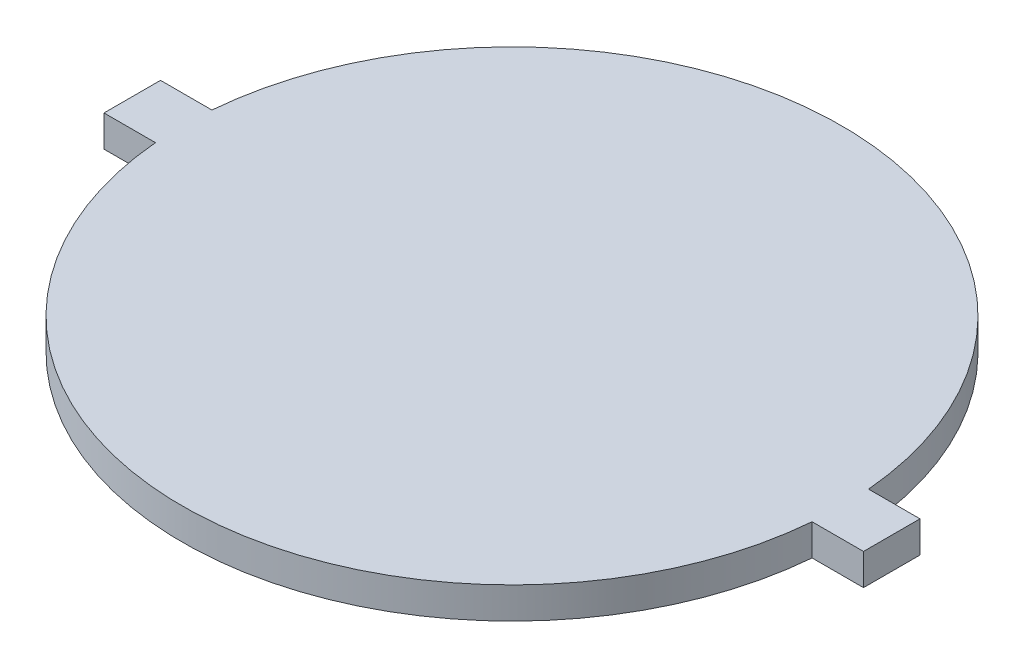
from build123d import *

# Parameters (mm, degrees)
SKETCH3_R           = 52.5
BOSS_EXTRUDE1_DEPTH = 5
SKETCH5_W           = 16
SKETCH5_H           = 9
BOSS_EXTRUDE2_DEPTH = 2.5


with BuildPart() as part:
    # Sketch3 → Boss-Extrude1 (new body)
    with BuildSketch(Plane(origin=(0, 0, 0), x_dir=(1, 0, 0), z_dir=(0, 1, 0))):
        with Locations(Location((0, 0, 0), (0, 0, 270))):
            Circle(SKETCH3_R)
    extrude(amount=BOSS_EXTRUDE1_DEPTH)

    # Sketch5 → Boss-Extrude2 (add, symmetric)
    with BuildSketch(Plane(origin=(0, 2.5, 0), x_dir=(1, 0, 0), z_dir=(0, 1, 0))):
        with Locations((52.5, 0)):
            Rectangle(SKETCH5_W, SKETCH5_H)
        with Locations((-52.5, 0)):
            Rectangle(SKETCH5_W, SKETCH5_H)
    extrude(amount=BOSS_EXTRUDE2_DEPTH, both=True)


solid = part.part
